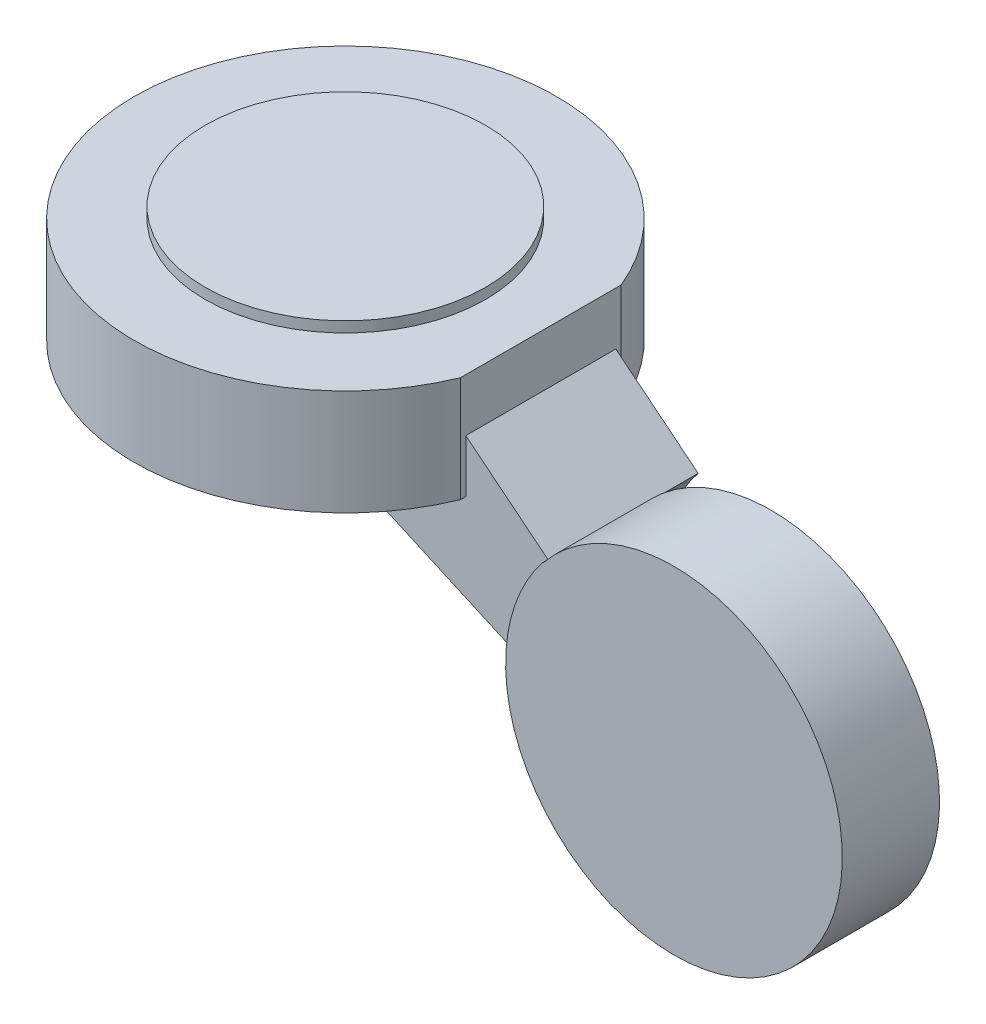
from build123d import *

# Parameters (mm, degrees)
SKETCH1_R           = 200
BOSS_EXTRUDE1_DEPTH = 100
CUT_EXTRUDE2_DEPTH  = 100
BOSS_EXTRUDE2_DEPTH = 75.993421
BOSS_EXTRUDE3_DEPTH = 75.993421
SKETCH9_R           = 159.375
BOSS_EXTRUDE4_DEPTH = 151.986842
CUT_EXTRUDE3_START  = -60
SKETCH11_R          = 159.375
CUT_EXTRUDE3_DEPTH  = 60
CUT_EXTRUDE4_DEPTH  = 5
CUT_EXTRUDE5_DEPTH  = 5
SKETCH15_R          = 132.8125
BOSS_EXTRUDE5_DEPTH = 10
SKETCH16_R          = 132.8125
BOSS_EXTRUDE6_DEPTH = 10


with BuildPart() as part:
    # Sketch1 → Boss-Extrude1 (new body)
    with BuildSketch(Plane(origin=(0, 0, 0), x_dir=(1, 0, 0), z_dir=(0, 1, 0))):
        with Locations(Location((0, 0, 0), (0, 0, 270))):
            Circle(SKETCH1_R)
    extrude(amount=BOSS_EXTRUDE1_DEPTH)

    # Sketch2 → Cut-Extrude2 (cut)
    with BuildSketch(Plane(origin=(0, 100, 0), x_dir=(1, 0, 0), z_dir=(0, 1, 0))):
        Polygon((185, 0), (185, 120.642549135), (200, 120.642549135), (200, 0), (200, -137.849885779), (185, -137.849885779), align=None)
    extrude(amount=-CUT_EXTRUDE2_DEPTH, mode=Mode.SUBTRACT)

    # Sketch4 → Boss-Extrude2 (add)
    with BuildSketch(Plane.XY):
        Polygon((185, 50), (185, 0), (0, 0), (251.924557131, -112.966443103), (387.075695624, -112.966443103), align=None)
    extrude(amount=-BOSS_EXTRUDE2_DEPTH)

    # Sketch7 → Boss-Extrude3 (add)
    with BuildSketch(Plane.XY):
        Polygon((0, 0), (185, 0), (185, 50), (387.075695624, -112.966443103), (251.924557131, -112.966443103), align=None)
    extrude(amount=BOSS_EXTRUDE3_DEPTH)

    # Sketch9 → Boss-Extrude4 (add)
    with BuildSketch(Plane.XY.offset(75.993420768)):
        with Locations((387.075695624, -112.966443103)):
            Circle(SKETCH9_R)
    extrude(amount=-BOSS_EXTRUDE4_DEPTH)

    # Sketch11 → Cut-Extrude3 (cut)
    with BuildSketch(Plane(origin=(0, 0, -75.993420768), x_dir=(-1, 0, 0), z_dir=(0, 0, -1)).offset(CUT_EXTRUDE3_START)):
        with Locations((-387.075695624, -112.966443103)):
            Circle(SKETCH11_R)
    extrude(amount=CUT_EXTRUDE3_DEPTH, mode=Mode.SUBTRACT)


with BuildPart() as cut_extrude3_kept_piece:
    # of the separate pieces the step leaves, the one the design keeps (cut_extrude3_pieces_kept)
    add(part.part.solids().sort_by_distance((185, 0, -75.993420884))[0])

    # Sketch12 → Cut-Extrude4 (cut)
    with BuildSketch(Plane.XY.offset(75.993420768)):
        with BuildLine():
            Line((185, 0), (0, 0))
            Line((0, 0), (228.060355378, -102.265406172))
            ThreePointArc((228.060355378, -102.265406172), (238.589276077, -54.846272892), (262.770904395, -12.719307371))
            Line((262.770904395, -12.719307371), (185, 50))
            Line((185, 50), (185, 0))
        make_face()
    extrude(amount=-CUT_EXTRUDE4_DEPTH, mode=Mode.SUBTRACT)

    # Sketch14 → Cut-Extrude5 (cut)
    with BuildSketch(Plane(origin=(0, 0, -75.993420768), x_dir=(-1, 0, 0), z_dir=(0, 0, -1))):
        with BuildLine():
            Line((-228.060355378, -102.265406172), (0, 0))
            Line((0, 0), (-185, 0))
            Line((-185, 0), (-185, 50))
            Line((-185, 50), (-263.016769179, -12.917588066))
            ThreePointArc((-263.016769179, -12.917588066), (-238.655621962, -54.898617596), (-228.060355378, -102.265406172))
        make_face()
    extrude(amount=-CUT_EXTRUDE5_DEPTH, mode=Mode.SUBTRACT)

    # Sketch15 → Boss-Extrude5 (add)
    with BuildSketch(Plane(origin=(0, 0, -15.993420768), x_dir=(-1, 0, 0), z_dir=(0, 0, -1))):
        with Locations((-387.075695624, -112.966443103)):
            Circle(SKETCH15_R)
    extrude(amount=BOSS_EXTRUDE5_DEPTH)

    # Sketch16 → Boss-Extrude6 (add)
    with BuildSketch(Plane(origin=(0, 100, 0), x_dir=(1, 0, 0), z_dir=(0, 1, 0))):
        with Locations(Location((0, 0, 0), (0, 0, 270))):
            Circle(SKETCH16_R)
    extrude(amount=BOSS_EXTRUDE6_DEPTH)


solid = cut_extrude3_kept_piece.part
